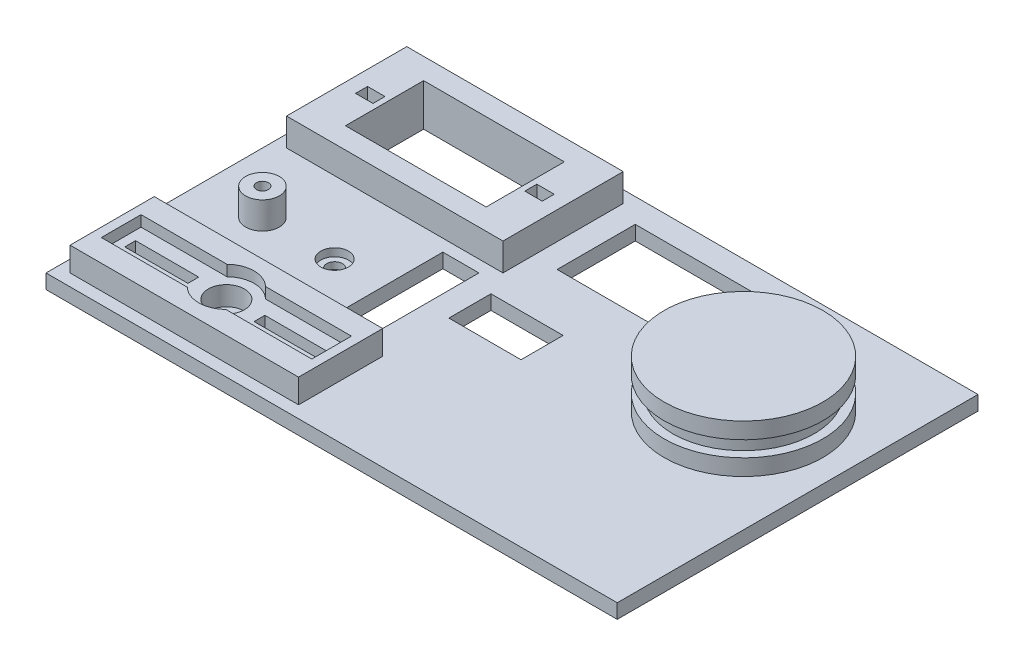
from build123d import *

# Parameters (mm, degrees)
SKETCH1_W            = 95
SKETCH1_H            = 2.4
BOSS_EXTRUDE1_DEPTH  = 60
BOSS_EXTRUDE2_START  = 2
SKETCH2_W            = 36
SKETCH2_H            = 4.6
BOSS_EXTRUDE2_DEPTH  = 20
BOSS_EXTRUDE3_START  = 5.5
SKETCH3_W            = 23.4
SKETCH3_H            = 9
BOSS_EXTRUDE3_DEPTH  = 13
BOSS_EXTRUDE4_START  = 11
SKETCH4_W            = 2.9
SKETCH4_H            = 9
BOSS_EXTRUDE4_DEPTH  = 2
BOSS_EXTRUDE5_START  = 11
SKETCH5_W            = 2.9
SKETCH5_H            = 9
BOSS_EXTRUDE5_DEPTH  = 2
BOSS_EXTRUDE6_START  = 4
SKETCH6_W            = 19.4
SKETCH6_H            = 4.4
BOSS_EXTRUDE6_DEPTH  = 13
BOSS_EXTRUDE7_START  = 2.4
SKETCH7_R            = 2.8
BOSS_EXTRUDE7_DEPTH  = 4.5
BOSS_EXTRUDE8_START  = 1.6
SKETCH8_R            = 1
BOSS_EXTRUDE8_DEPTH  = 6.3
BOSS_EXTRUDE9_START  = -1
SKETCH9_R            = 1.3
BOSS_EXTRUDE9_DEPTH  = 4.4
BOSS_EXTRUDE10_START = 1.1
SKETCH10_R           = 2.3
BOSS_EXTRUDE10_DEPTH = 2.3
BOSS_EXTRUDE11_START = 24
SKETCH11_W           = 6
SKETCH11_H           = 4.4
BOSS_EXTRUDE11_DEPTH = 17
BOSS_EXTRUDE12_START = 26
SKETCH12_W           = 12
SKETCH12_H           = 4.4
BOSS_EXTRUDE12_DEPTH = 7
BOSS_EXTRUDE13_START = 2.4
SKETCH13_R           = 13.2
BOSS_EXTRUDE13_DEPTH = 8
BOSS_EXTRUDE14_START = 5.1
SKETCH14_R           = 20
BOSS_EXTRUDE14_DEPTH = 2.6
BOSS_EXTRUDE15_START = 5.1
SKETCH15_R           = 11.75
BOSS_EXTRUDE15_DEPTH = 2.6
BOSS_EXTRUDE16_START = 44
SKETCH16_W           = 38
SKETCH16_H           = 4
BOSS_EXTRUDE16_DEPTH = 14
BOSS_EXTRUDE17_START = 4.6
SKETCH17_R           = 4.6
BOSS_EXTRUDE17_DEPTH = 2.3
BOSS_EXTRUDE18_START = 47.7
SKETCH18_W           = 17.5
SKETCH18_H           = 2.3
BOSS_EXTRUDE18_DEPTH = 6.6
BOSS_EXTRUDE19_START = 50.1
SKETCH19_W           = 10.5
SKETCH19_H           = 6
BOSS_EXTRUDE19_DEPTH = 1.8
BOSS_EXTRUDE20_START = 47.7
SKETCH20_W           = 17.5
SKETCH20_H           = 2.3
BOSS_EXTRUDE20_DEPTH = 6.6
BOSS_EXTRUDE21_START = 50.1
SKETCH21_W           = 10.5
SKETCH21_H           = 6
BOSS_EXTRUDE21_DEPTH = 1.8
BOSS_EXTRUDE22_START = 1.4
SKETCH22_R           = 3
BOSS_EXTRUDE22_DEPTH = 6


with BuildPart() as part:
    # Sketch1 → Boss-Extrude1 (new body)
    with BuildSketch(Plane.XY):
        with Locations((197.5, 1.2)):
            Rectangle(SKETCH1_W, SKETCH1_H)
    extrude(amount=BOSS_EXTRUDE1_DEPTH)

    # Sketch2 → Boss-Extrude2 (add)
    with BuildSketch(Plane.XY.offset(BOSS_EXTRUDE2_START)):
        with Locations((170, 4.7)):
            Rectangle(SKETCH2_W, SKETCH2_H)
    extrude(amount=BOSS_EXTRUDE2_DEPTH)


with BuildPart() as body_2:
    # Sketch3 → Boss-Extrude3 (new body)
    with BuildSketch(Plane.XY.offset(BOSS_EXTRUDE3_START)):
        with Locations((170, 3.5)):
            Rectangle(SKETCH3_W, SKETCH3_H)
    extrude(amount=BOSS_EXTRUDE3_DEPTH)


with BuildPart() as part_1:
    add(part.part)

    # Combine1: cut body 2
    add(body_2.part, mode=Mode.SUBTRACT)


with BuildPart() as body_2_2:
    # Sketch4 → Boss-Extrude4 (new body)
    with BuildSketch(Plane.XY.offset(BOSS_EXTRUDE4_START)):
        with Locations((155.925, 3.5)):
            Rectangle(SKETCH4_W, SKETCH4_H)
    extrude(amount=BOSS_EXTRUDE4_DEPTH)


with BuildPart() as part_2:
    add(part_1.part)

    # Combine2: cut body 2 2
    add(body_2_2.part, mode=Mode.SUBTRACT)


with BuildPart() as body_2_3:
    # Sketch5 → Boss-Extrude5 (new body)
    with BuildSketch(Plane.XY.offset(BOSS_EXTRUDE5_START)):
        with Locations((184.075, 3.5)):
            Rectangle(SKETCH5_W, SKETCH5_H)
    extrude(amount=BOSS_EXTRUDE5_DEPTH)


with BuildPart() as part_3:
    add(part_2.part)

    # Combine3: cut body 2 3
    add(body_2_3.part, mode=Mode.SUBTRACT)


with BuildPart() as body_2_4:
    # Sketch6 → Boss-Extrude6 (new body)
    with BuildSketch(Plane.XY.offset(BOSS_EXTRUDE6_START)):
        with Locations((201.7, 1.2)):
            Rectangle(SKETCH6_W, SKETCH6_H)
    extrude(amount=BOSS_EXTRUDE6_DEPTH)


with BuildPart() as part_4:
    add(part_3.part)

    # Combine4: cut body 2 4
    add(body_2_4.part, mode=Mode.SUBTRACT)

    # Sketch7 → Boss-Extrude7 (add)
    with BuildSketch(Plane(origin=(0, 0, 0), x_dir=(1, 0, 0), z_dir=(0, 1, 0)).offset(BOSS_EXTRUDE7_START)):
        with Locations((160, -34)):
            Circle(SKETCH7_R)
    extrude(amount=BOSS_EXTRUDE7_DEPTH)


with BuildPart() as body_2_5:
    # Sketch8 → Boss-Extrude8 (new body)
    with BuildSketch(Plane(origin=(0, 0, 0), x_dir=(1, 0, 0), z_dir=(0, 1, 0)).offset(BOSS_EXTRUDE8_START)):
        with Locations((160, -34)):
            Circle(SKETCH8_R)
    extrude(amount=BOSS_EXTRUDE8_DEPTH)


with BuildPart() as part_5:
    add(part_4.part)

    # Combine5: cut body 2 5
    add(body_2_5.part, mode=Mode.SUBTRACT)


with BuildPart() as body_2_6:
    # Sketch9 → Boss-Extrude9 (new body)
    with BuildSketch(Plane(origin=(0, 0, 0), x_dir=(1, 0, 0), z_dir=(0, 1, 0)).offset(BOSS_EXTRUDE9_START)):
        with Locations((172, -34)):
            Circle(SKETCH9_R)
    extrude(amount=BOSS_EXTRUDE9_DEPTH)


with BuildPart() as part_6:
    add(part_5.part)

    # Combine6: cut body 2 6
    add(body_2_6.part, mode=Mode.SUBTRACT)


with BuildPart() as body_2_7:
    # Sketch10 → Boss-Extrude10 (new body)
    with BuildSketch(Plane(origin=(0, 0, 0), x_dir=(1, 0, 0), z_dir=(0, 1, 0)).offset(BOSS_EXTRUDE10_START)):
        with Locations((172, -34)):
            Circle(SKETCH10_R)
    extrude(amount=BOSS_EXTRUDE10_DEPTH)


with BuildPart() as part_7:
    add(part_6.part)

    # Combine7: cut body 2 7
    add(body_2_7.part, mode=Mode.SUBTRACT)


with BuildPart() as body_2_8:
    # Sketch11 → Boss-Extrude11 (new body)
    with BuildSketch(Plane.XY.offset(BOSS_EXTRUDE11_START)):
        with Locations((183, 1.2)):
            Rectangle(SKETCH11_W, SKETCH11_H)
    extrude(amount=BOSS_EXTRUDE11_DEPTH)


with BuildPart() as part_8:
    add(part_7.part)

    # Combine8: cut body 2 8
    add(body_2_8.part, mode=Mode.SUBTRACT)


with BuildPart() as body_2_9:
    # Sketch12 → Boss-Extrude12 (new body)
    with BuildSketch(Plane.XY.offset(BOSS_EXTRUDE12_START)):
        with Locations((196, 1.2)):
            Rectangle(SKETCH12_W, SKETCH12_H)
    extrude(amount=BOSS_EXTRUDE12_DEPTH)


with BuildPart() as part_9:
    add(part_8.part)

    # Combine9: cut body 2 9
    add(body_2_9.part, mode=Mode.SUBTRACT)

    # Sketch13 → Boss-Extrude13 (add)
    with BuildSketch(Plane(origin=(0, 0, 0), x_dir=(1, 0, 0), z_dir=(0, 1, 0)).offset(BOSS_EXTRUDE13_START)):
        with Locations((228, -22)):
            Circle(SKETCH13_R)
    extrude(amount=BOSS_EXTRUDE13_DEPTH)


with BuildPart() as body_2_10:
    # Sketch14 → Boss-Extrude14 (new body)
    with BuildSketch(Plane(origin=(0, 0, 0), x_dir=(1, 0, 0), z_dir=(0, 1, 0)).offset(BOSS_EXTRUDE14_START)):
        with Locations((228, -22)):
            Circle(SKETCH14_R)
    extrude(amount=BOSS_EXTRUDE14_DEPTH)


with BuildPart() as part_10:
    add(part_9.part)

    # Combine10: cut body 2 10
    add(body_2_10.part, mode=Mode.SUBTRACT)

    # Sketch15 → Boss-Extrude15 (add)
    with BuildSketch(Plane(origin=(0, 0, 0), x_dir=(1, 0, 0), z_dir=(0, 1, 0)).offset(BOSS_EXTRUDE15_START)):
        with Locations((228, -22)):
            Circle(SKETCH15_R)
    extrude(amount=BOSS_EXTRUDE15_DEPTH)

    # Sketch16 → Boss-Extrude16 (add)
    with BuildSketch(Plane.XY.offset(BOSS_EXTRUDE16_START)):
        with Locations((171, 4.4)):
            Rectangle(SKETCH16_W, SKETCH16_H)
    extrude(amount=BOSS_EXTRUDE16_DEPTH)


with BuildPart() as body_2_11:
    # Sketch17 → Boss-Extrude17 (new body)
    with BuildSketch(Plane(origin=(0, 0, 0), x_dir=(1, 0, 0), z_dir=(0, 1, 0)).offset(BOSS_EXTRUDE17_START)):
        with Locations((171, -51)):
            Circle(SKETCH17_R)
    extrude(amount=BOSS_EXTRUDE17_DEPTH)


with BuildPart() as part_11:
    add(part_10.part)

    # Combine11: cut body 2 11
    add(body_2_11.part, mode=Mode.SUBTRACT)


with BuildPart() as body_2_12:
    # Sketch18 → Boss-Extrude18 (new body)
    with BuildSketch(Plane.XY.offset(BOSS_EXTRUDE18_START)):
        with Locations((179.75, 5.75)):
            Rectangle(SKETCH18_W, SKETCH18_H)
    extrude(amount=BOSS_EXTRUDE18_DEPTH)


with BuildPart() as part_12:
    add(part_11.part)

    # Combine12: cut body 2 12
    add(body_2_12.part, mode=Mode.SUBTRACT)


with BuildPart() as body_2_13:
    # Sketch19 → Boss-Extrude19 (new body)
    with BuildSketch(Plane.XY.offset(BOSS_EXTRUDE19_START)):
        with Locations((181.75, 4.4)):
            Rectangle(SKETCH19_W, SKETCH19_H)
    extrude(amount=BOSS_EXTRUDE19_DEPTH)


with BuildPart() as part_13:
    add(part_12.part)

    # Combine13: cut body 2 13
    add(body_2_13.part, mode=Mode.SUBTRACT)


with BuildPart() as body_2_14:
    # Sketch20 → Boss-Extrude20 (new body)
    with BuildSketch(Plane.XY.offset(BOSS_EXTRUDE20_START)):
        with Locations((162.25, 5.75)):
            Rectangle(SKETCH20_W, SKETCH20_H)
    extrude(amount=BOSS_EXTRUDE20_DEPTH)


with BuildPart() as part_14:
    add(part_13.part)

    # Combine14: cut body 2 14
    add(body_2_14.part, mode=Mode.SUBTRACT)


with BuildPart() as body_2_15:
    # Sketch21 → Boss-Extrude21 (new body)
    with BuildSketch(Plane.XY.offset(BOSS_EXTRUDE21_START)):
        with Locations((160.25, 4.4)):
            Rectangle(SKETCH21_W, SKETCH21_H)
    extrude(amount=BOSS_EXTRUDE21_DEPTH)


with BuildPart() as part_15:
    add(part_14.part)

    # Combine15: cut body 2 15
    add(body_2_15.part, mode=Mode.SUBTRACT)


with BuildPart() as body_2_16:
    # Sketch22 → Boss-Extrude22 (new body)
    with BuildSketch(Plane(origin=(0, 0, 0), x_dir=(1, 0, 0), z_dir=(0, 1, 0)).offset(BOSS_EXTRUDE22_START)):
        with Locations((171, -51)):
            Circle(SKETCH22_R)
    extrude(amount=BOSS_EXTRUDE22_DEPTH)


with BuildPart() as part_16:
    add(part_15.part)

    # Combine16: cut body 2 16
    add(body_2_16.part, mode=Mode.SUBTRACT)


solid = part_16.part
